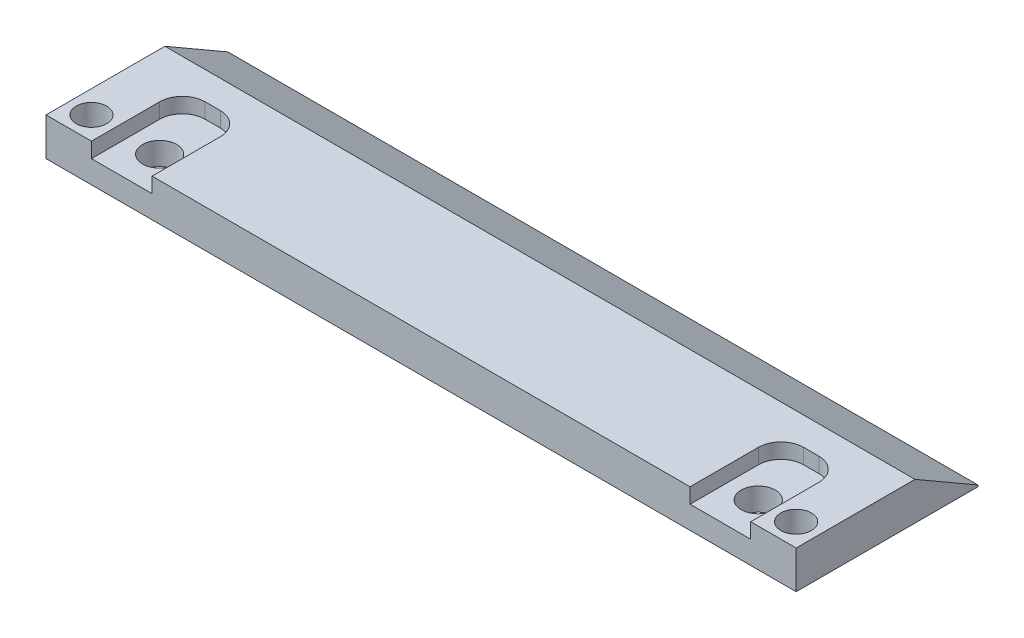
from build123d import *

# Parameters (mm, degrees)
CROQUIS1_W              = 99
CROQUIS1_H              = 24
CROQUIS1_R              = 2.017504942
CROQUIS1_R_2            = 2.25
SALIENTE_EXTRUIR1_DEPTH = 5
CORTAR_EXTRUIR1_DEPTH   = 2
CORTAR_EXTRUIR5_DEPTH   = 141


with BuildPart() as part:
    # Croquis1 → Saliente-Extruir1 (new body)
    with BuildSketch(Plane(origin=(0, 0, 0), x_dir=(1, 0, 0), z_dir=(0, 1, 0))):
        Rectangle(CROQUIS1_W, CROQUIS1_H)
        with Locations(Location((-46.5, -9, 0), (0, 0, 270))):
            Circle(CROQUIS1_R, mode=Mode.SUBTRACT)
        with Locations(Location((-39.5, -7, 0), (0, 0, 270))):
            Circle(CROQUIS1_R_2, mode=Mode.SUBTRACT)
        with Locations(Location((39.5, -7, 0), (0, 0, 270))):
            Circle(CROQUIS1_R_2, mode=Mode.SUBTRACT)
        with Locations(Location((46.5, -9, 0), (0, 0, 270))):
            Circle(CROQUIS1_R, mode=Mode.SUBTRACT)
    extrude(amount=SALIENTE_EXTRUIR1_DEPTH)

    # Croquis2 → Cortar-Extruir1 (cut)
    with BuildSketch(Plane(origin=(0, 5, 0), x_dir=(1, 0, 0), z_dir=(0, 1, 0))):
        with BuildLine():
            Line((-43.5, -3), (-43.5, -12))
            Line((-43.5, -12), (-35.5, -12))
            Line((-35.5, -12), (-35.5, -3))
            ThreePointArc((-35.5, -3), (-36.378679656, -0.878679656), (-38.5, 0))
            Line((-38.5, 0), (-40.5, 0))
            ThreePointArc((-40.5, 0), (-42.621320344, -0.878679656), (-43.5, -3))
        make_face()
        with BuildLine():
            Line((40.5, 0), (38.5, 0))
            ThreePointArc((38.5, 0), (36.378679656, -0.878679656), (35.5, -3))
            Line((35.5, -3), (35.5, -12))
            Line((35.5, -12), (43.5, -12))
            Line((43.5, -12), (43.5, -3))
            ThreePointArc((43.5, -3), (42.621320344, -0.878679656), (40.5, 0))
        make_face()
    extrude(amount=-CORTAR_EXTRUIR1_DEPTH, mode=Mode.SUBTRACT)

    # Croquis3 → Cortar-Extruir5 (cut)
    with BuildSketch(Plane.ZY.offset(49.5)):
        Polygon((-12, 5), (-12, 0.2), (-6.100895765, 3.605849418), (-3.686156124, 5), align=None)
        Polygon((-12.757171087, 0.2), (-12, 0.2), (-12, 5), (-3.686156124, 5), (-3.039853353, 5.373143079), (-12.757171087, 5.373143079), align=None)
    extrude(amount=-CORTAR_EXTRUIR5_DEPTH, mode=Mode.SUBTRACT)


solid = part.part
